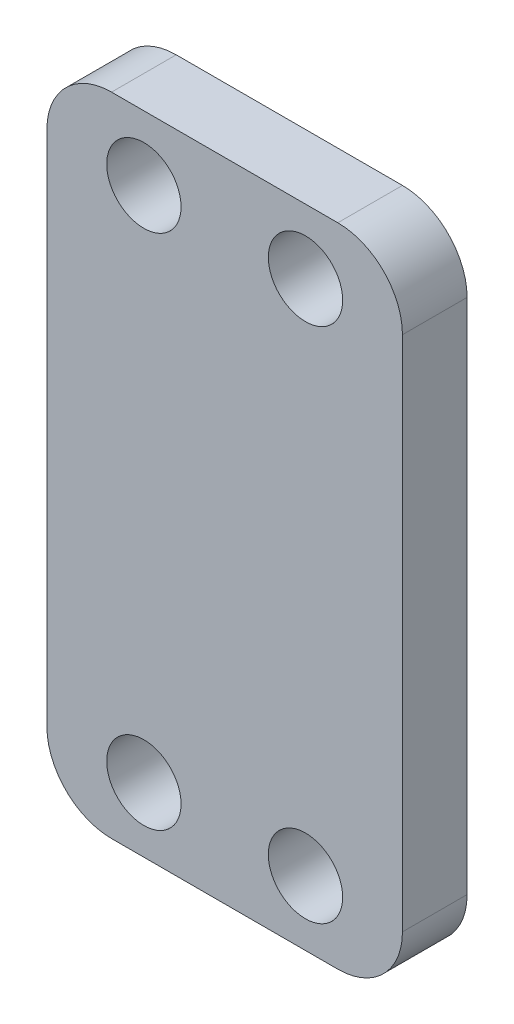
from build123d import *

# Parameters (mm, degrees)
SKETCH_1_W          = 11
SKETCH_1_H          = 20
EXTRUDE_1_DEPTH     = 1
SKETCH_2_R          = 1.15
CUT_EXTRUDE_1_DEPTH = 12.586630226
FILLET_1_R          = 2


with BuildPart() as part:
    # 草图1 → 凸台-拉伸1 (new, symmetric)
    with BuildSketch(Plane.XY):
        Rectangle(SKETCH_1_W, SKETCH_1_H)
    extrude(amount=EXTRUDE_1_DEPTH, both=True)

    # 草图2 → 切除-拉伸1 (cut, through all)
    with BuildSketch(Plane.XY.offset(1)):
        with Locations((-2.5, 8)):
            Circle(SKETCH_2_R)
        with Locations((2.5, 8)):
            Circle(SKETCH_2_R)
        with Locations((-2.5, -8)):
            Circle(SKETCH_2_R)
        with Locations((2.5, -8)):
            Circle(SKETCH_2_R)
    extrude(amount=-CUT_EXTRUDE_1_DEPTH, mode=Mode.SUBTRACT)

    # 圆角1
    fillet_1_edges = [part.edges().sort_by_distance(p)[0] for p in [
        (5.5, -10, 0),
        (-5.5, -10, 0),
        (-5.5, 10, 0),
        (5.5, 10, 0),
    ]]
    fillet(fillet_1_edges, radius=FILLET_1_R)


solid = part.part
